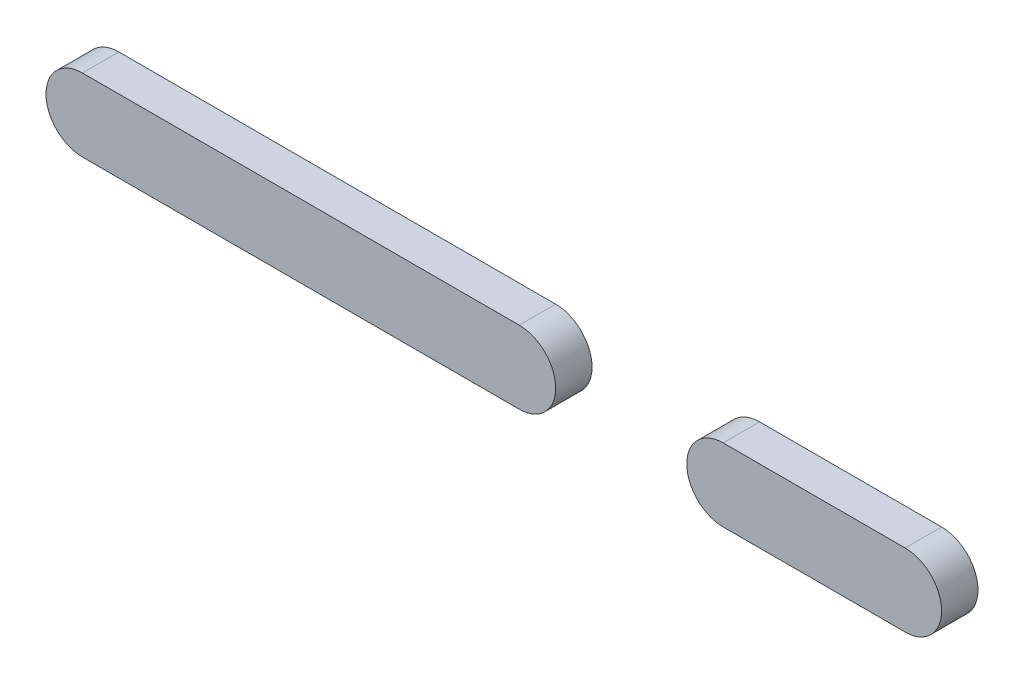
from build123d import *

# Parameters (mm, degrees)
EXTRUDE_1_DEPTH   = 1
EXTRUDE_1_2_DEPTH = 1


with BuildPart() as part:
    # 草图1 → 凸台-拉伸1 (new body)
    with BuildSketch(Plane.XY):
        with BuildLine():
            Line((-16.568527919, -0.586762193), (-4.568527919, -0.586762193))
            ThreePointArc((-4.568527919, -0.586762193), (-3.568527919, -1.586762193), (-4.568527919, -2.586762193))
            Line((-4.568527919, -2.586762193), (-16.568527919, -2.586762193))
            ThreePointArc((-16.568527919, -2.586762193), (-17.568527919, -1.586762193), (-16.568527919, -0.586762193))
        make_face()
    extrude(amount=EXTRUDE_1_DEPTH)


with BuildPart() as body_2:
    # 草图1 → Extrude 1 2 (new body)
    with BuildSketch(Plane.XY):
        with BuildLine():
            Line((1.032994924, -0.586762193), (6.032994924, -0.586762193))
            ThreePointArc((6.032994924, -0.586762193), (7.032994924, -1.586762193), (6.032994924, -2.586762193))
            Line((6.032994924, -2.586762193), (1.032994924, -2.586762193))
            ThreePointArc((1.032994924, -2.586762193), (0.032994924, -1.586762193), (1.032994924, -0.586762193))
        make_face()
    extrude(amount=EXTRUDE_1_2_DEPTH)


solid = Compound([part.part, body_2.part])
